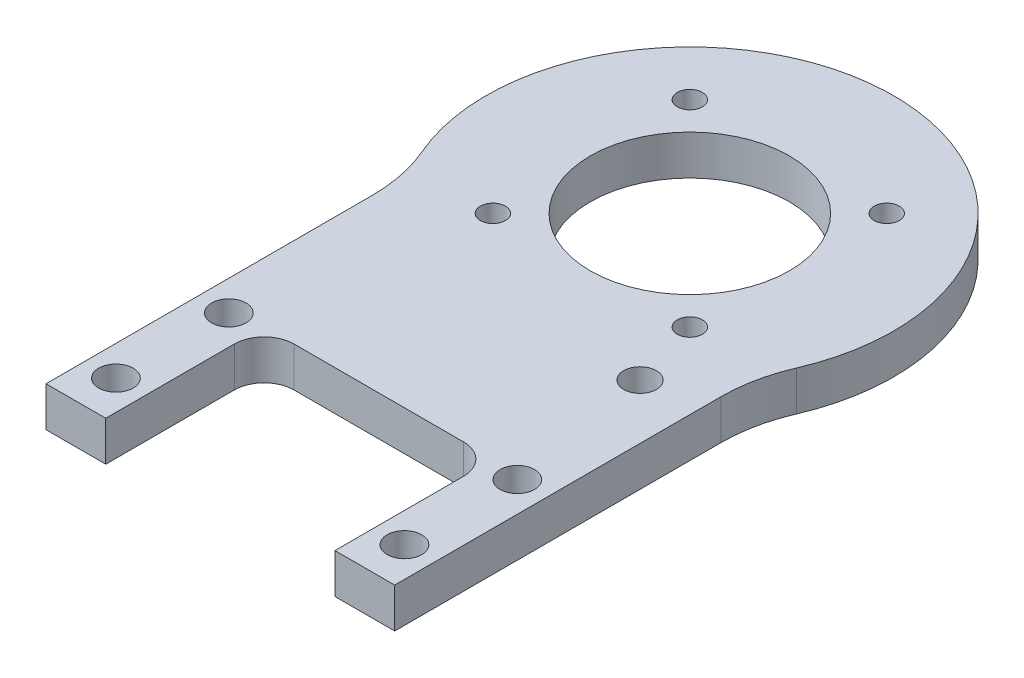
from build123d import *

# Parameters (mm, degrees)
SKETCH1_R           = 2.75
SKETCH1_R_2         = 15.875
SKETCH1_R_3         = 1.999996
BOSS_EXTRUDE1_DEPTH = 6.35
SKETCH2_R           = 2.6035
CUT_EXTRUDE1_DEPTH  = 6.35


with BuildPart() as part:
    # Sketch1 → Boss-Extrude1 (new body)
    with BuildSketch(Plane(origin=(0, 594.769027045, 0), x_dir=(1, 0, 0), z_dir=(0, 1, 0))):
        with BuildLine():
            Line((18.270000003, -51.148426992), (18.270000003, -71.640926991))
            Line((18.270000003, -71.640926991), (27.795000003, -71.640926991))
            Line((27.795000003, -71.640926991), (27.795000003, -19.656099647))
            ThreePointArc((27.795000003, -19.656099647), (28.316356539, -14.536226662), (29.859023577, -9.626533144))
            ThreePointArc((29.859023577, -9.626533144), (0, 35.706571509), (-29.859023577, -9.626533144))
            ThreePointArc((-29.859023577, -9.626533144), (-28.316356539, -14.536226662), (-27.795000003, -19.656099647))
            Line((-27.795000003, -19.656099647), (-27.795000003, -71.640926991))
            Line((-27.795000003, -71.640926991), (-18.270000003, -71.640926991))
            Line((-18.270000003, -71.640926991), (-18.270000003, -51.148426992))
            ThreePointArc((-18.270000003, -51.148426992), (-16.875096049, -47.780830946), (-13.507500003, -46.385926992))
            Line((-13.507500003, -46.385926992), (0, -46.385926991))
            Line((0, -46.385926991), (13.507500003, -46.385926992))
            ThreePointArc((13.507500003, -46.385926992), (16.875096049, -47.780830946), (18.270000003, -51.148426992))
        make_face()
        with Locations(Location((-23, -65.290926991, 0), (0, 0, 270))):
            Circle(SKETCH1_R, mode=Mode.SUBTRACT)
        with Locations(Location((-23, -47.290926991, 0), (0, 0, 270))):
            Circle(SKETCH1_R, mode=Mode.SUBTRACT)
        with Locations(Location((23, -47.290926991, 0), (0, 0, 270))):
            Circle(SKETCH1_R, mode=Mode.SUBTRACT)
        with Locations(Location((23, -65.290926991, 0), (0, 0, 270))):
            Circle(SKETCH1_R, mode=Mode.SUBTRACT)
        with Locations(Location((0, 3.206573009, 0), (0, 0, 270))):
            Circle(SKETCH1_R_2, mode=Mode.SUBTRACT)
        with Locations(Location((-15.697770542, -12.491197534, 0), (0, 0, 270))):
            Circle(SKETCH1_R_3, mode=Mode.SUBTRACT)
        with Locations(Location((-15.697770542, 18.904343551, 0), (0, 0, 270))):
            Circle(SKETCH1_R_3, mode=Mode.SUBTRACT)
        with Locations(Location((15.697770542, 18.904343551, 0), (0, 0, 270))):
            Circle(SKETCH1_R_3, mode=Mode.SUBTRACT)
        with Locations(Location((15.697770542, -12.491197534, 0), (0, 0, 270))):
            Circle(SKETCH1_R_3, mode=Mode.SUBTRACT)
    extrude(amount=BOSS_EXTRUDE1_DEPTH)

    # Sketch2 → Cut-Extrude1 (cut)
    with BuildSketch(Plane(origin=(0, 601.119027045, 0), x_dir=(1, 0, 0), z_dir=(0, 1, 0))):
        with Locations(Location((19.05, -23.780926991, 0), (0, 0, 270))):
            Circle(SKETCH2_R)
    extrude(amount=-CUT_EXTRUDE1_DEPTH, mode=Mode.SUBTRACT)


solid = part.part
